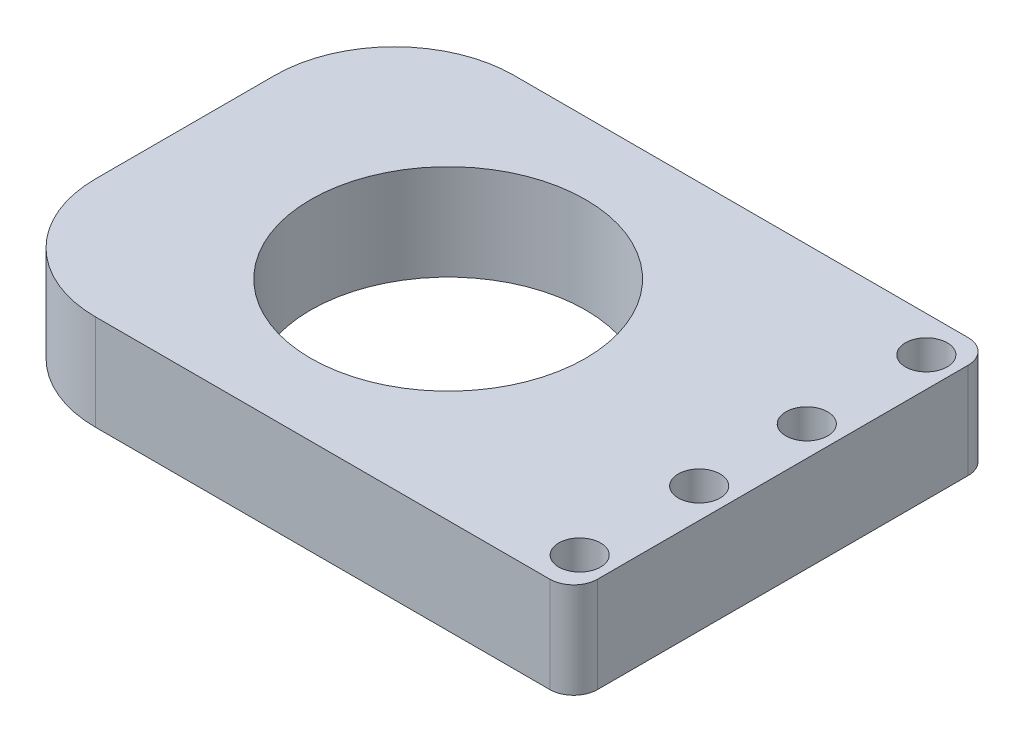
from build123d import *

# Parameters (mm, degrees)
SKETCH1_W           = 50
SKETCH1_H           = 35
SKETCH1_R           = 11.5
BOSS_EXTRUDE1_DEPTH = 8
FILLET3_R           = 10
FILLET4_R           = 2
SKETCH2_R           = 1.75
CUT_EXTRUDE1_DEPTH  = 34.974254959


with BuildPart() as part:
    # Sketch1 → Boss-Extrude1 (new body)
    with BuildSketch(Plane(origin=(0, 0, 0), x_dir=(1, 0, 0), z_dir=(0, 1, 0))):
        with Locations((3, 0)):
            Rectangle(SKETCH1_W, SKETCH1_H)
        with Locations(Location((0, 0, 0), (0, 0, 270))):
            Circle(SKETCH1_R, mode=Mode.SUBTRACT)
    extrude(amount=BOSS_EXTRUDE1_DEPTH)

    # Fillet3
    fillet3_edges = [part.edges().sort_by_distance(p)[0] for p in [
        (-22, 4, 17.5),
        (-22, 4, -17.5),
    ]]
    fillet(fillet3_edges, radius=FILLET3_R)

    # Fillet4
    fillet4_edges = [part.edges().sort_by_distance(p)[0] for p in [
        (28, 4, 17.5),
        (28, 4, -17.5),
    ]]
    fillet(fillet4_edges, radius=FILLET4_R)

    # Sketch2 → Cut-Extrude1 (cut, through all)
    with BuildSketch(Plane(origin=(0, 8, 0), x_dir=(1, 0, 0), z_dir=(0, 1, 0))):
        with Locations(Location((25.5, 4.5, 0), (0, 0, 270))):
            Circle(SKETCH2_R)
        with Locations(Location((25.5, -4.5, 0), (0, 0, 270))):
            Circle(SKETCH2_R)
        with Locations(Location((25.5, -14.5, 0), (0, 0, 270))):
            Circle(SKETCH2_R)
        with Locations(Location((25.5, 14.5, 0), (0, 0, 270))):
            Circle(SKETCH2_R)
    extrude(amount=-CUT_EXTRUDE1_DEPTH, mode=Mode.SUBTRACT)


solid = part.part
